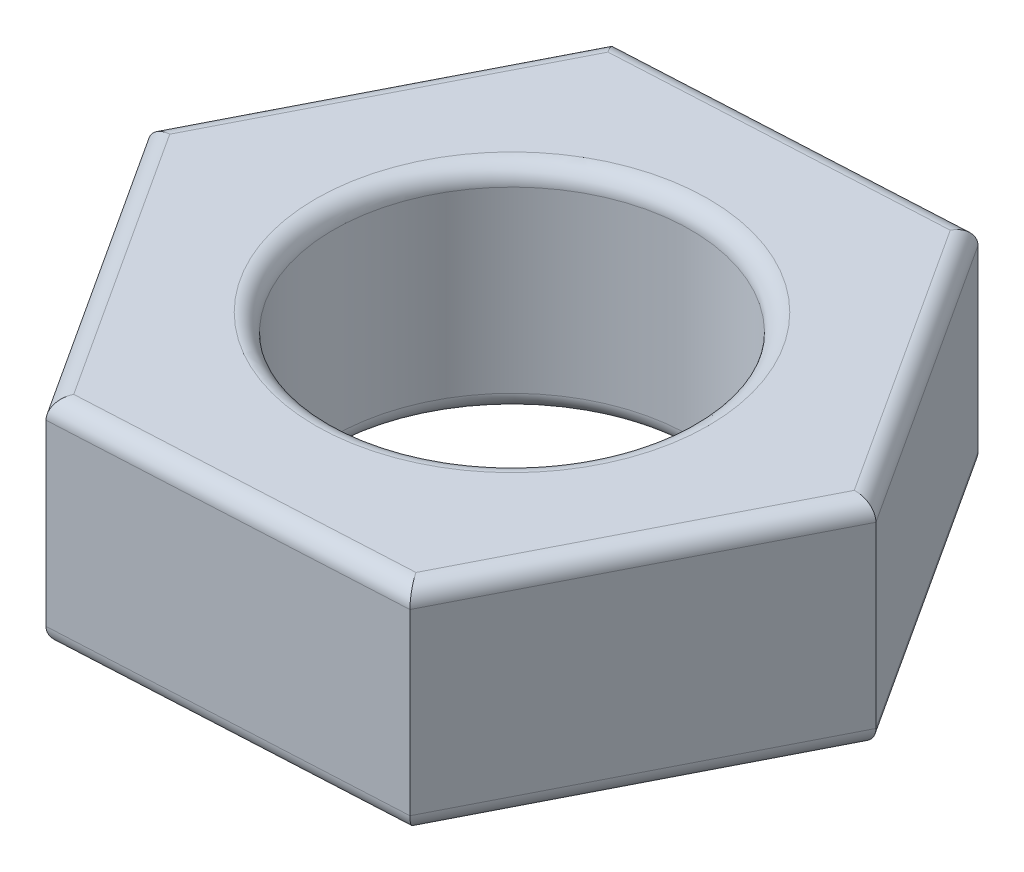
from build123d import *

# Parameters (mm, degrees)
SKETCH1_R           = 5
BOSS_EXTRUDE1_DEPTH = 6
FILLET1_R           = 0.5


with BuildPart() as part:
    # Sketch1 → Boss-Extrude1 (new body)
    with BuildSketch(Plane(origin=(0, 0, 0), x_dir=(1, 0, 0), z_dir=(0, 1, 0))):
        Polygon((5.279294532, -8.136894324), (9.686404459, 0.503556016), (4.407109927, 8.640450341), (-5.279294532, 8.136894324), (-9.686404459, -0.503556016), (-4.407109927, -8.640450341), align=None)
        with Locations(Location((0, 0, 0), (0, 0, 270))):
            Circle(SKETCH1_R, mode=Mode.SUBTRACT)
    extrude(amount=BOSS_EXTRUDE1_DEPTH)

    # Fillet1
    fillet1_edges = [part.edges().sort_by_distance(p)[0] for p in [
        (7.046757193, 6, -4.572003179),
        (-0.436092303, 6, -8.388672333),
        (-7.482849495, 6, -3.816669154),
        (0, 0, -5),
        (0, 6, -5),
        (-7.046757193, 6, 4.572003179),
        (0.436092303, 6, 8.388672333),
        (-7.046757193, 0, 4.572003179),
        (-7.482849495, 0, -3.816669154),
        (-0.436092303, 0, -8.388672333),
        (7.482849495, 6, 3.816669154),
        (7.046757193, 0, -4.572003179),
        (7.482849495, 0, 3.816669154),
        (0.436092303, 0, 8.388672333),
    ]]
    fillet(fillet1_edges, radius=FILLET1_R)


solid = part.part
